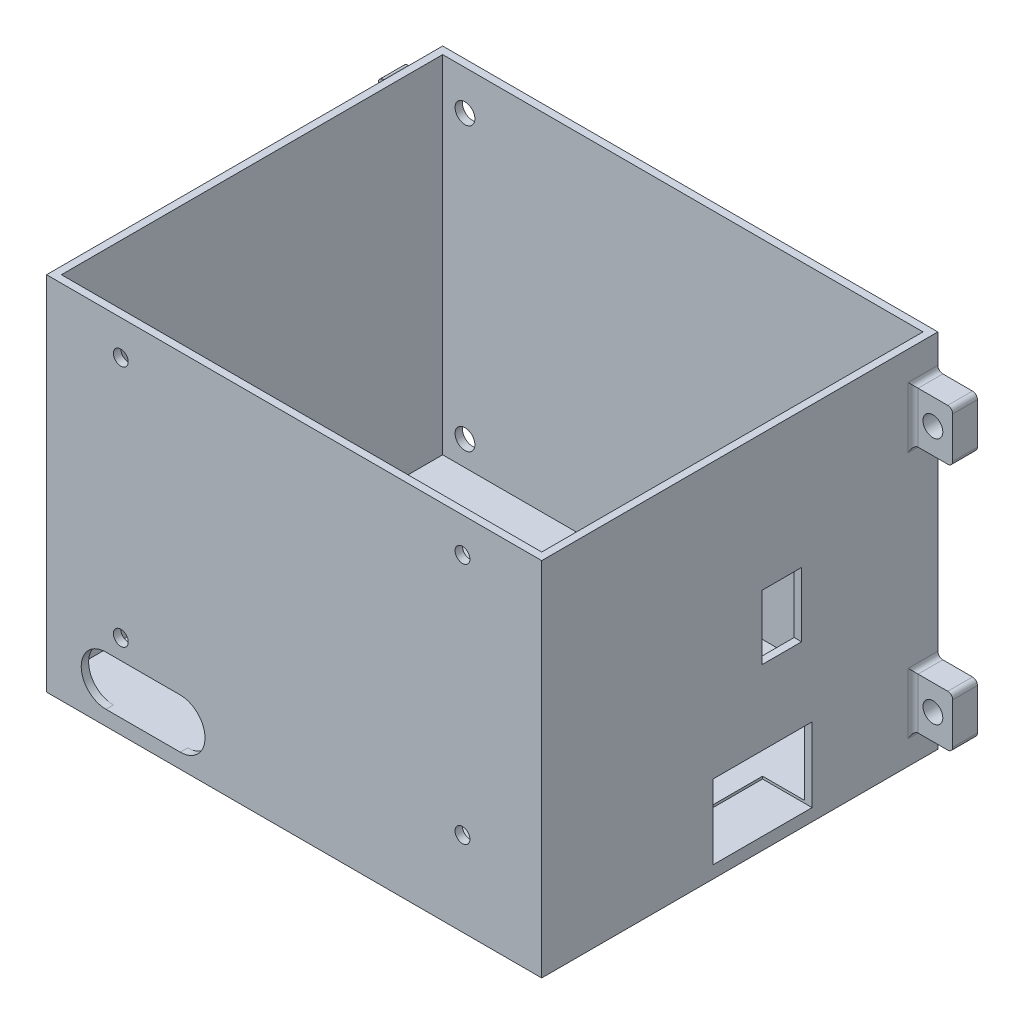
from build123d import *

# Parameters (mm, degrees)
SKETCH1_W               = 100
SKETCH1_H               = 80
BOSS_EXTRUDE1_DEPTH     = 3
SKETCH2_W               = 100
SKETCH2_H               = 80
SKETCH2_W_2             = 97
SKETCH2_H_2             = 77
BOSS_EXTRUDE2_DEPTH     = 70
CUT_EXTRUDE1_DEPTH      = 3
SKETCH5_W               = 8
SKETCH5_H               = 10.304098564
SKETCH5_R               = 2
BOSS_EXTRUDE4_DEPTH     = 5
FILLET8_R               = 1
FILLET9_R               = 1
FILLET10_R              = 1
FILLET11_R              = 1
FILLET12_R              = 1
FILLET13_R              = 1
FILLET14_R              = 1
FILLET15_R              = 1
FILLET16_R              = 1
FILLET17_R              = 1
SKETCH3_R               = 1.5
CUT_EXTRUDE2_DEPTH      = 10
SKETCH7_R               = 1.5
CUT_EXTRUDE4_DEPTH      = 10
SKETCH8_R               = 2
CUT_EXTRUDE5_DEPTH      = 10
SKETCH9_W               = 20
SKETCH9_H               = 15
SKETCH9_W_2             = 8
SKETCH9_H_2             = 13
CUT_EXTRUDE7_DEPTH      = 10
LPATTERN1_COUNT         = 2
LPATTERN1_PITCH         = 50
FILLET8_OF_LPATTERN1_R  = 1
FILLET9_OF_LPATTERN1_R  = 1
FILLET10_OF_LPATTERN1_R = 1
FILLET11_OF_LPATTERN1_R = 1
FILLET12_OF_LPATTERN1_R = 1
FILLET13_OF_LPATTERN1_R = 1
FILLET14_OF_LPATTERN1_R = 1
FILLET15_OF_LPATTERN1_R = 1
FILLET16_OF_LPATTERN1_R = 1
FILLET17_OF_LPATTERN1_R = 1


with BuildPart() as part:
    # Sketch1 → Boss-Extrude1 (new body)
    with BuildSketch(Plane(origin=(0, 0, 0), x_dir=(1, 0, 0), z_dir=(0, 1, 0))):
        Rectangle(SKETCH1_W, SKETCH1_H)
    extrude(amount=BOSS_EXTRUDE1_DEPTH)

    # Sketch2 → Boss-Extrude2 (add)
    with BuildSketch(Plane(origin=(0, 3, 0), x_dir=(1, 0, 0), z_dir=(0, 1, 0))):
        Rectangle(SKETCH2_W, SKETCH2_H)
        Rectangle(SKETCH2_W_2, SKETCH2_H_2, mode=Mode.SUBTRACT)
    extrude(amount=BOSS_EXTRUDE2_DEPTH)

    # Sketch4 → Cut-Extrude1 (cut)
    with BuildSketch(Plane.XY.offset(40)):
        with BuildLine():
            Line((-38, 13), (-23, 13))
            ThreePointArc((-23, 13), (-18, 8), (-23, 3))
            Line((-23, 3), (-38, 3))
            ThreePointArc((-38, 3), (-43, 8), (-38, 13))
        make_face()
    extrude(amount=-CUT_EXTRUDE1_DEPTH, mode=Mode.SUBTRACT)

    # Sketch5 → Boss-Extrude4 (add)
    # profile 1 of 2: a face of its own
    with BuildSketch(Plane(origin=(0, 0, -40), x_dir=(-1, 0, 0), z_dir=(0, 0, -1))):
        with Locations((54, 11)):
            Rectangle(SKETCH5_W, SKETCH5_H)
        with Locations((54, 11)):
            Circle(SKETCH5_R, mode=Mode.SUBTRACT)
    # profile 2 of 2: a face of its own
    with BuildSketch(Plane(origin=(0, 0, -40), x_dir=(-1, 0, 0), z_dir=(0, 0, -1))):
        with Locations((-54, 11)):
            Rectangle(SKETCH5_W, SKETCH5_H)
        with Locations((-54, 11)):
            Circle(SKETCH5_R, mode=Mode.SUBTRACT)
    boss_extrude4 = extrude(amount=-BOSS_EXTRUDE4_DEPTH)

    # Fillet8
    fillet8_edges = [part.edges().sort_by_distance(p)[0] for p in [
        (58, 16.152049282, -37.5),
    ]]
    fillet(fillet8_edges, radius=FILLET8_R)

    # Fillet9
    fillet9_edges = [part.edges().sort_by_distance(p)[0] for p in [
        (58, 5.847950718, -37.5),
    ]]
    fillet(fillet9_edges, radius=FILLET9_R)

    # Fillet10
    fillet10_edges = [part.edges().sort_by_distance(p)[0] for p in [
        (50, 5.847950718, -37.5),
    ]]
    fillet(fillet10_edges, radius=FILLET10_R)

    # Fillet11
    fillet11_edges = [part.edges().sort_by_distance(p)[0] for p in [
        (50, 16.152049282, -37.5),
    ]]
    fillet(fillet11_edges, radius=FILLET11_R)

    # Fillet12
    fillet12_edges = [part.edges().sort_by_distance(p)[0] for p in [
        (50, 11, -35),
    ]]
    fillet(fillet12_edges, radius=FILLET12_R)

    # Fillet13
    fillet13_edges = [part.edges().sort_by_distance(p)[0] for p in [
        (-58, 5.847950718, -37.5),
    ]]
    fillet(fillet13_edges, radius=FILLET13_R)

    # Fillet14
    fillet14_edges = [part.edges().sort_by_distance(p)[0] for p in [
        (-58, 16.152049282, -37.5),
    ]]
    fillet(fillet14_edges, radius=FILLET14_R)

    # Fillet15
    fillet15_edges = [part.edges().sort_by_distance(p)[0] for p in [
        (-50, 5.847950718, -37.5),
    ]]
    fillet(fillet15_edges, radius=FILLET15_R)

    # Fillet16
    fillet16_edges = [part.edges().sort_by_distance(p)[0] for p in [
        (-50, 16.152049282, -37.5),
    ]]
    fillet(fillet16_edges, radius=FILLET16_R)

    # Fillet17
    fillet17_edges = [part.edges().sort_by_distance(p)[0] for p in [
        (-50, 11, -35),
    ]]
    fillet(fillet17_edges, radius=FILLET17_R)

    # Sketch3 → Cut-Extrude2 (cut)
    with BuildSketch(Plane(origin=(0, 3, 0), x_dir=(1, 0, 0), z_dir=(0, 1, 0))):
        with Locations(Location((-38.5, 28.5, 0), (0, 0, 270))):
            Circle(SKETCH3_R)
        with Locations(Location((-38.5, -20.5, 0), (0, 0, 270))):
            Circle(SKETCH3_R)
        with Locations(Location((19.5, 28.5, 0), (0, 0, 270))):
            Circle(SKETCH3_R)
        with Locations(Location((19.5, -20.5, 0), (0, 0, 270))):
            Circle(SKETCH3_R)
    extrude(amount=-CUT_EXTRUDE2_DEPTH, mode=Mode.SUBTRACT)

    # Sketch7 → Cut-Extrude4 (cut)
    with BuildSketch(Plane.XY.offset(40)):
        with Locations((-35, 66)):
            Circle(SKETCH7_R)
        with Locations((34, 66)):
            Circle(SKETCH7_R)
        with Locations((-35, 17)):
            Circle(SKETCH7_R)
        with Locations((34, 17)):
            Circle(SKETCH7_R)
    extrude(amount=-CUT_EXTRUDE4_DEPTH, mode=Mode.SUBTRACT)

    # Sketch8 → Cut-Extrude5 (cut)
    with BuildSketch(Plane(origin=(0, 0, -40), x_dir=(-1, 0, 0), z_dir=(0, 0, -1))):
        with Locations((-45, 65)):
            Circle(SKETCH8_R)
        with Locations((44, 65)):
            Circle(SKETCH8_R)
        with Locations((-45, 8)):
            Circle(SKETCH8_R)
        with Locations((44, 8)):
            Circle(SKETCH8_R)
    extrude(amount=-CUT_EXTRUDE5_DEPTH, mode=Mode.SUBTRACT)

    # Sketch9 → Cut-Extrude7 (cut)
    with BuildSketch(Plane(origin=(50, 0, 0), x_dir=(0, 0, -1), z_dir=(1, 0, 0))):
        with Locations((4.6, 10)):
            Rectangle(SKETCH9_W, SKETCH9_H)
        with Locations((8.475245753, 39.06044871)):
            Rectangle(SKETCH9_W_2, SKETCH9_H_2)
    extrude(amount=-CUT_EXTRUDE7_DEPTH, mode=Mode.SUBTRACT)

    # LPattern1: Boss-Extrude4 ×2
    with Locations(*[(0, i * LPATTERN1_PITCH, 0) for i in range(1, LPATTERN1_COUNT)]):
        add(boss_extrude4)

    # Fillet8 of LPattern1
    fillet8_of_lpattern1_edges = [part.edges().sort_by_distance(p)[0] for p in [
        (58, 66.152049282, -37.5),
    ]]
    fillet(fillet8_of_lpattern1_edges, radius=FILLET8_OF_LPATTERN1_R)

    # Fillet9 of LPattern1
    fillet9_of_lpattern1_edges = [part.edges().sort_by_distance(p)[0] for p in [
        (58, 55.847950718, -37.5),
    ]]
    fillet(fillet9_of_lpattern1_edges, radius=FILLET9_OF_LPATTERN1_R)

    # Fillet10 of LPattern1
    fillet10_of_lpattern1_edges = [part.edges().sort_by_distance(p)[0] for p in [
        (50, 55.847950718, -37.5),
    ]]
    fillet(fillet10_of_lpattern1_edges, radius=FILLET10_OF_LPATTERN1_R)

    # Fillet11 of LPattern1
    fillet11_of_lpattern1_edges = [part.edges().sort_by_distance(p)[0] for p in [
        (50, 66.152049282, -37.5),
    ]]
    fillet(fillet11_of_lpattern1_edges, radius=FILLET11_OF_LPATTERN1_R)

    # Fillet12 of LPattern1
    fillet12_of_lpattern1_edges = [part.edges().sort_by_distance(p)[0] for p in [
        (50, 61, -35),
    ]]
    fillet(fillet12_of_lpattern1_edges, radius=FILLET12_OF_LPATTERN1_R)

    # Fillet13 of LPattern1
    fillet13_of_lpattern1_edges = [part.edges().sort_by_distance(p)[0] for p in [
        (-58, 55.847950718, -37.5),
    ]]
    fillet(fillet13_of_lpattern1_edges, radius=FILLET13_OF_LPATTERN1_R)

    # Fillet14 of LPattern1
    fillet14_of_lpattern1_edges = [part.edges().sort_by_distance(p)[0] for p in [
        (-58, 66.152049282, -37.5),
    ]]
    fillet(fillet14_of_lpattern1_edges, radius=FILLET14_OF_LPATTERN1_R)

    # Fillet15 of LPattern1
    fillet15_of_lpattern1_edges = [part.edges().sort_by_distance(p)[0] for p in [
        (-50, 55.847950718, -37.5),
    ]]
    fillet(fillet15_of_lpattern1_edges, radius=FILLET15_OF_LPATTERN1_R)

    # Fillet16 of LPattern1
    fillet16_of_lpattern1_edges = [part.edges().sort_by_distance(p)[0] for p in [
        (-50, 66.152049282, -37.5),
    ]]
    fillet(fillet16_of_lpattern1_edges, radius=FILLET16_OF_LPATTERN1_R)

    # Fillet17 of LPattern1
    fillet17_of_lpattern1_edges = [part.edges().sort_by_distance(p)[0] for p in [
        (-50, 61, -35),
    ]]
    fillet(fillet17_of_lpattern1_edges, radius=FILLET17_OF_LPATTERN1_R)


solid = part.part
